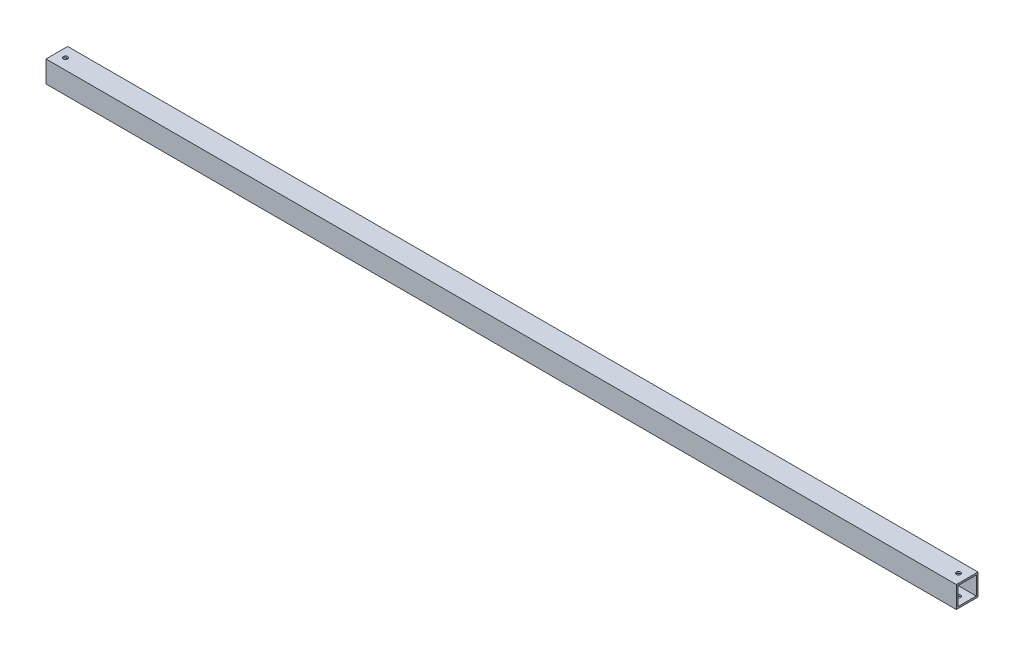
from build123d import *

# Parameters (mm, degrees)
SKETCH_1_W          = 630
SKETCH_1_H          = 15
EXTRUDE_1_DEPTH     = 15
SKETCH_2_R          = 1.5
CUT_EXTRUDE_1_DEPTH = 631.357041684
SKETCH_3_W          = 12.6
SKETCH_3_H          = 12.6
CUT_EXTRUDE_2_DEPTH = 631.357041684


with BuildPart() as part:
    # ｽｹｯﾁ1 → ﾎﾞｽ - 押し出し1 (new body)
    with BuildSketch(Plane.XY):
        with Locations((315, 7.5)):
            Rectangle(SKETCH_1_W, SKETCH_1_H)
    extrude(amount=EXTRUDE_1_DEPTH)

    # ｽｹｯﾁ2 → ｶｯﾄ - 押し出し1 (cut, through all)
    with BuildSketch(Plane(origin=(0, 15, 0), x_dir=(1, 0, 0), z_dir=(0, 1, 0))):
        with Locations(Location((6, -7.5, 0), (0, 0, 270))):
            Circle(SKETCH_2_R)
        with Locations(Location((624, -7.5, 0), (0, 0, 270))):
            Circle(SKETCH_2_R)
    extrude(amount=-CUT_EXTRUDE_1_DEPTH, mode=Mode.SUBTRACT)

    # ｽｹｯﾁ3 → ｶｯﾄ - 押し出し2 (cut, through all)
    with BuildSketch(Plane.ZY):
        with Locations((7.5, 7.5)):
            Rectangle(SKETCH_3_W, SKETCH_3_H)
    extrude(amount=-CUT_EXTRUDE_2_DEPTH, mode=Mode.SUBTRACT)


solid = part.part
